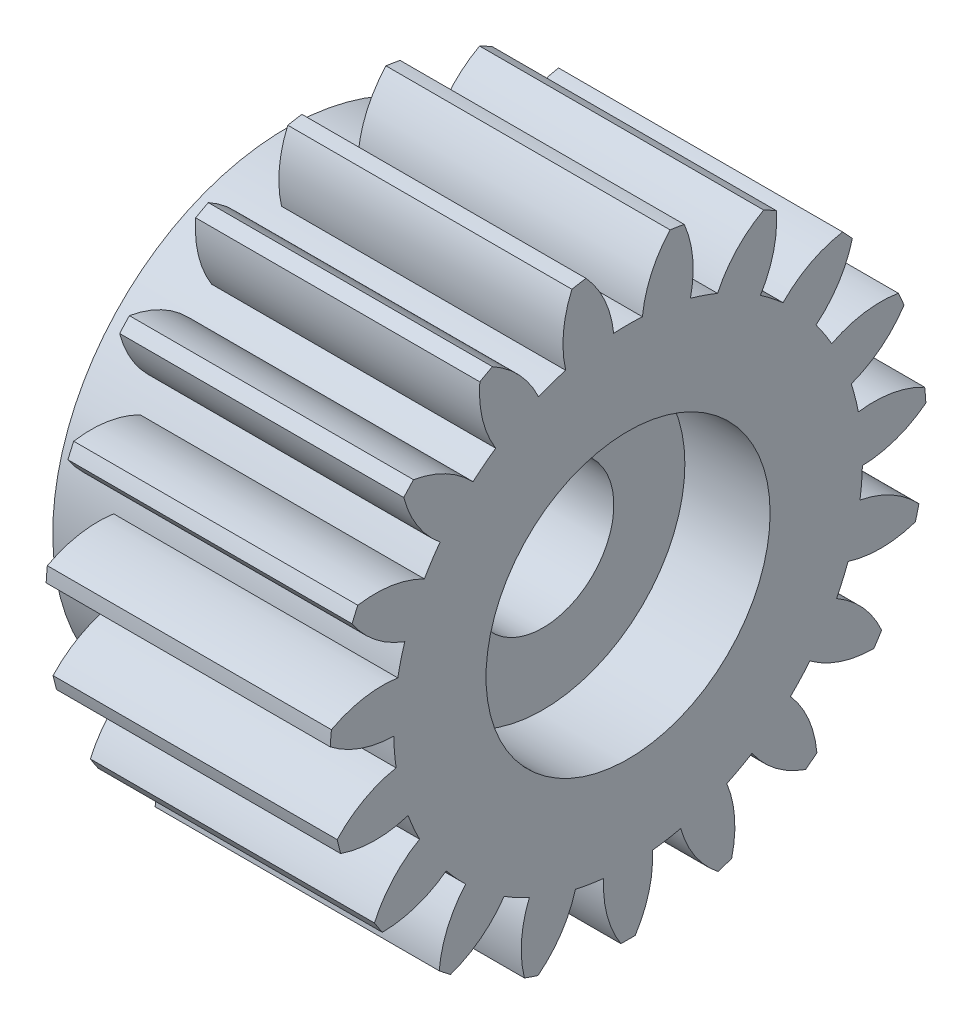
from build123d import *
from build123d.topology import SkipClean

# Parameters (mm, degrees)
BASPROSKE_W         = 12
BASPROSKE_H         = 10.5
TOOTHCUT_DEPTH      = 20.091883092
TEETHCUTS_COUNT     = 19
BORSKE_R            = 2.5
BORE_DEPTH          = 50.0000508
SKETCH1_R           = 5
CUT_EXTRUDE1_DEPTH  = 3
BOSS_EXTRUDE1_DEPTH = 9
SKETCH3_R           = 10.5
SKETCH3_R_2         = 8.249
CUT_EXTRUDE2_DEPTH  = 2


with BuildPart() as part:
    # BasProSke → Base-Revolve (revolve)
    with BuildSketch(Plane(origin=(0, 0, 0), x_dir=(1, 0, 0), z_dir=(0, 1, 0)), mode=Mode.PRIVATE) as base_revolve_sk:
        with Locations((6, 5.25)):
            Rectangle(BASPROSKE_W, BASPROSKE_H)
    revolve(base_revolve_sk.sketch.rotate(Axis((-10, 0, 0), (1, 0, 0)), 180), axis=Axis((-10, 0, 0), (1, 0, 0)))

    # TooCutSke → ToothCut (cut, through all)
    with BuildSketch(Plane(origin=(0, 0, 0), x_dir=(0, 0, -1), z_dir=(1, 0, 0))):
        with BuildLine():
            ThreePointArc((0.505024765, 8.233526036), (0, 8.249), (-0.505024765, 8.233526036))
            ThreePointArc((-0.505024765, 8.233526036), (-0.825185426, 9.406360648), (-1.499357972, 10.41805984))
            ThreePointArc((-1.499357972, 10.41805984), (0, 10.5254), (1.499357972, 10.41805984))
            ThreePointArc((1.499357972, 10.41805984), (0.825185426, 9.406360648), (0.505024765, 8.233526036))
        make_face()
    toothcut = extrude(amount=TOOTHCUT_DEPTH, mode=Mode.SUBTRACT)

    # TeethCuts: ToothCut ×19 about axis
    teethcuts_axis = Axis((0, 0, 0), (1, 0, 0))
    for i in range(1, TEETHCUTS_COUNT):
        add(toothcut.rotate(teethcuts_axis, i * 360 / TEETHCUTS_COUNT), mode=Mode.SUBTRACT)

    # BorSke → Bore (cut, symmetric)
    with BuildSketch(Plane(origin=(0, 0, 0), x_dir=(0, 0, -1), z_dir=(1, 0, 0))):
        with Locations(Location((0, 0, 0), (0, 0, 180))):
            Circle(BORSKE_R)
    extrude(amount=BORE_DEPTH, both=True, mode=Mode.SUBTRACT)

    # Sketch1 → Cut-Extrude1 (cut)
    with BuildSketch(Plane(origin=(12, 0, 0), x_dir=(0, 0, -1), z_dir=(1, 0, 0))):
        Circle(SKETCH1_R)
    extrude(amount=-CUT_EXTRUDE1_DEPTH, mode=Mode.SUBTRACT)

    # Sketch2 → Boss-Extrude1 (add)
    with BuildSketch(Plane(origin=(9, 0, 0), x_dir=(0, 0, -1), z_dir=(1, 0, 0))):
        with BuildLine():
            Line((-2.085372664, -1.378847653), (-2.085372664, 1.378847653))
            ThreePointArc((-2.085372664, 1.378847653), (-2.5, 0), (-2.085372664, -1.378847653))
        make_face()
    extrude(amount=-BOSS_EXTRUDE1_DEPTH)

    # Sketch3 → Cut-Extrude2 (cut)
    with SkipClean():  # the faces are left unmerged after this step: merging them gives an invalid solid
        with BuildSketch(Plane.ZY):
            Circle(SKETCH3_R)
            with Locations(Location((0, 0, 0), (0, 0, 358.773146294))):
                Circle(SKETCH3_R_2, mode=Mode.SUBTRACT)
        extrude(amount=-CUT_EXTRUDE2_DEPTH, mode=Mode.SUBTRACT)


solid = part.part
